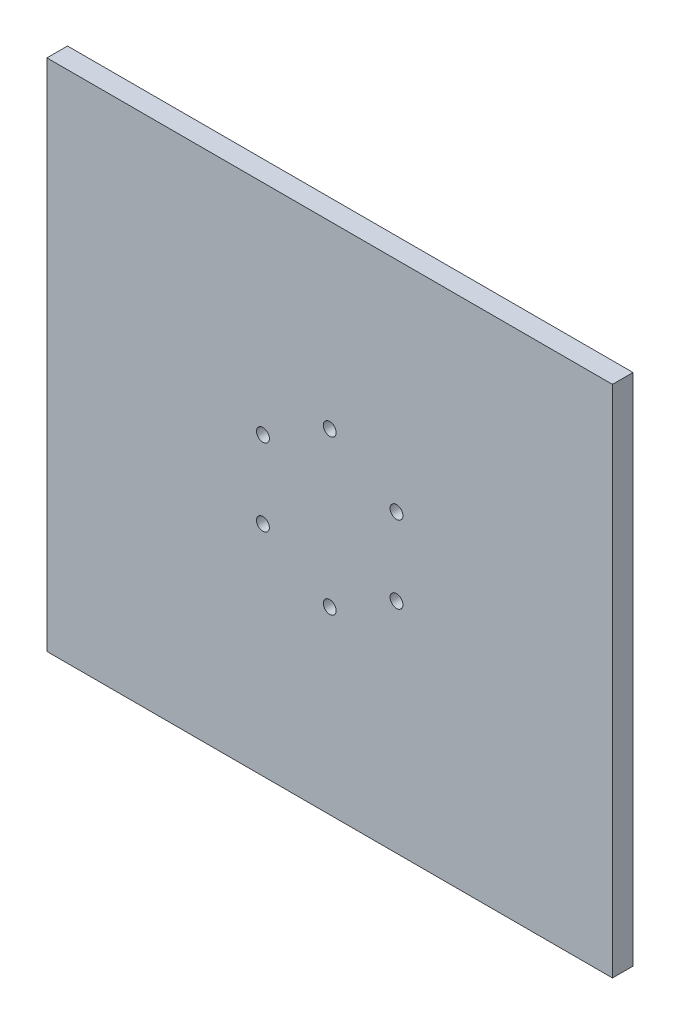
from build123d import *

# Parameters (mm, degrees)
SKETCH_1_W          = 220
SKETCH_1_H          = 200
EXTRUDE_1_DEPTH     = 8
SKETCH_2_R          = 2.5
CUT_EXTRUDE_1_DEPTH = 298.42898312


with BuildPart() as part:
    # 草图1 → 凸台-拉伸1 (new body)
    with BuildSketch(Plane.XY):
        with Locations((110, -100)):
            Rectangle(SKETCH_1_W, SKETCH_1_H)
    extrude(amount=EXTRUDE_1_DEPTH)

    # 草图2 → 切除-拉伸1 (cut, through all)
    with BuildSketch(Plane.XY.offset(8)):
        with Locations((110, -70)):
            Circle(SKETCH_2_R)
        with Locations((135.980762114, -85)):
            Circle(SKETCH_2_R)
        with Locations((135.980762114, -115)):
            Circle(SKETCH_2_R)
        with Locations((110, -130)):
            Circle(SKETCH_2_R)
        with Locations((84.019237886, -115)):
            Circle(SKETCH_2_R)
        with Locations((84.019237886, -85)):
            Circle(SKETCH_2_R)
    extrude(amount=-CUT_EXTRUDE_1_DEPTH, mode=Mode.SUBTRACT)


solid = part.part
